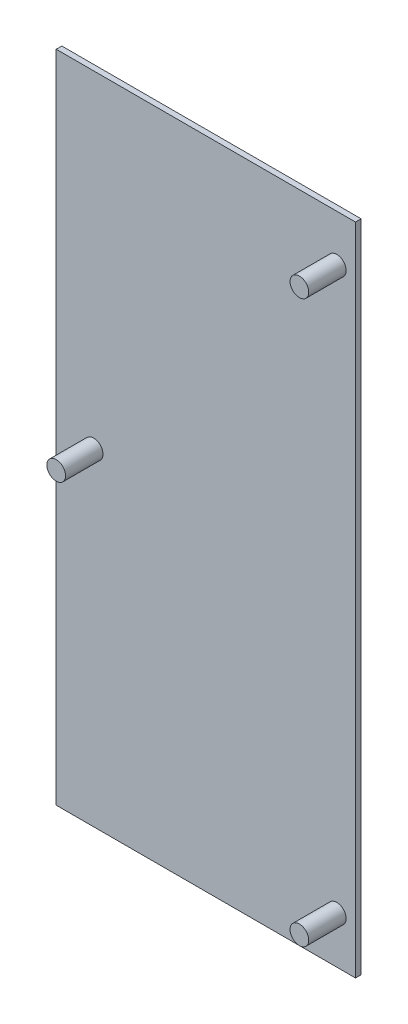
from build123d import *

# Parameters (mm, degrees)
SKETCH1_W           = 160
SKETCH1_H           = 350
BOSS_EXTRUDE1_DEPTH = 3
SKETCH2_R           = 5
BOSS_EXTRUDE2_DEPTH = 20
SKETCH3_R           = 5
BOSS_EXTRUDE3_DEPTH = 20


with BuildPart() as part:
    # Sketch1 → Boss-Extrude1 (new body)
    with BuildSketch(Plane.XY):
        Rectangle(SKETCH1_W, SKETCH1_H)
    extrude(amount=BOSS_EXTRUDE1_DEPTH)

    # Sketch2 → Boss-Extrude2 (add)
    with BuildSketch(Plane.XY.offset(3)):
        with Locations((70, 150)):
            Circle(SKETCH2_R)
    boss_extrude2 = extrude(amount=BOSS_EXTRUDE2_DEPTH)

    # Mirror1: Boss-Extrude2 across plane
    add(boss_extrude2.mirror(Plane.ZX))

    # Sketch3 → Boss-Extrude3 (add)
    with BuildSketch(Plane.XY.offset(3)):
        with Locations((-60, 0)):
            Circle(SKETCH3_R)
    extrude(amount=BOSS_EXTRUDE3_DEPTH)


solid = part.part
